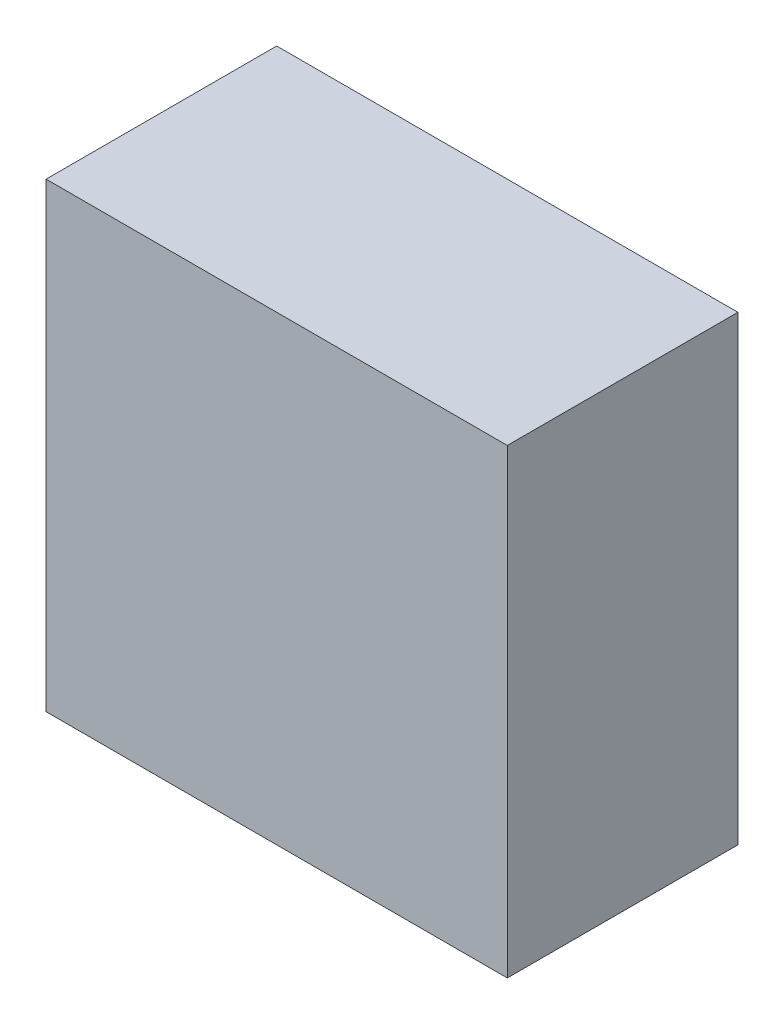
from build123d import *

# Parameters (mm, degrees)
SZKIC1_W                    = 200
SZKIC1_H                    = 200
DODANIE_WYCI_GNI_CIE1_DEPTH = 100


with BuildPart() as part:
    # Szkic1 → Dodanie-wyciągnięcie1 (new body)
    with BuildSketch(Plane.XY):
        with Locations((-7.865168539, -8.426966292)):
            Rectangle(SZKIC1_W, SZKIC1_H)
    extrude(amount=DODANIE_WYCI_GNI_CIE1_DEPTH)


solid = part.part
